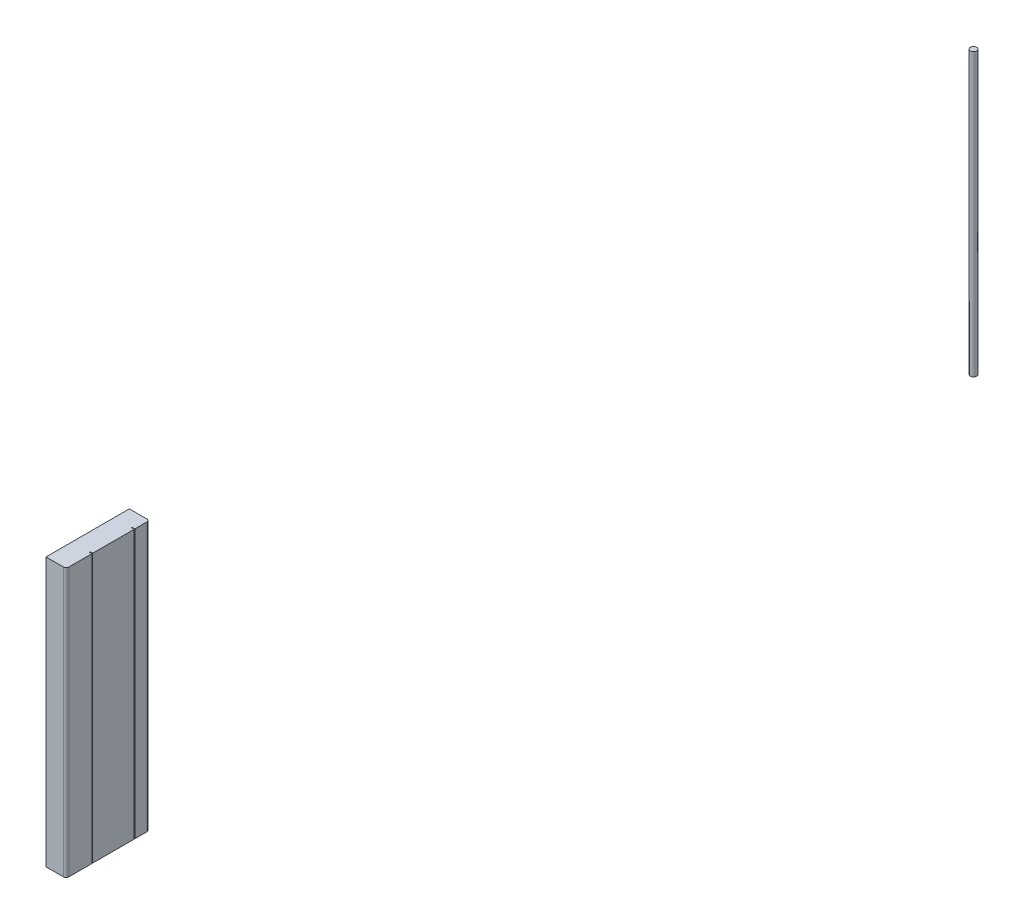
from build123d import *

# Parameters (mm, degrees)
SKETCH_1_W          = 62.1
SKETCH_1_H          = 200
EXTRUDE_1_DEPTH     = 15
SKETCH_2_W          = 2
SKETCH_2_H          = 0.5
CUT_EXTRUDE_1_DEPTH = 210.003939351
FILLET_1_R          = 2
EXTRUDE_START       = -10
SKETCH_3_R          = 2.359977166
EXTRUDE_2_DEPTH     = 210


with BuildPart() as part:
    # Эскиз1 → Бобышка-Вытянуть1 (new body)
    with BuildSketch(Plane(origin=(0, 0, 0), x_dir=(0, 0, -1), z_dir=(1, 0, 0))):
        with Locations((-27.751757321, 92.321211536)):
            Rectangle(SKETCH_1_W, SKETCH_1_H)
    extrude(amount=EXTRUDE_1_DEPTH)

    # Эскиз2 → Вырез-Вытянуть1 (cut, through all)
    with BuildSketch(Plane(origin=(0, 192.321211536, 0), x_dir=(1, 0, 0), z_dir=(0, 1, 0))):
        with Locations((14, -39.251757321)):
            Rectangle(SKETCH_2_W, SKETCH_2_H)
        with Locations((14, -7.851757321)):
            Rectangle(SKETCH_2_W, SKETCH_2_H)
    extrude(amount=-CUT_EXTRUDE_1_DEPTH, mode=Mode.SUBTRACT)

    # Скругление1
    fillet_1_edges = [part.edges().sort_by_distance(p)[0] for p in [
        (15, 92.321211536, -3.298242679),
        (15, 92.321211536, 58.801757321),
    ]]
    fillet(fillet_1_edges, radius=FILLET_1_R)


with BuildPart() as body_2:
    # Эскиз3 → Бобышка-Вытянуть2 (new body)
    with BuildSketch(Plane(origin=(0, 0, 0), x_dir=(1, 0, 0), z_dir=(0, 1, 0)).offset(EXTRUDE_START)):
        with Locations(Location((25.5, 606.898242679, 0), (0, 0, 270))):
            Circle(SKETCH_3_R)
    extrude(amount=EXTRUDE_2_DEPTH)


solid = Compound([part.part, body_2.part])
